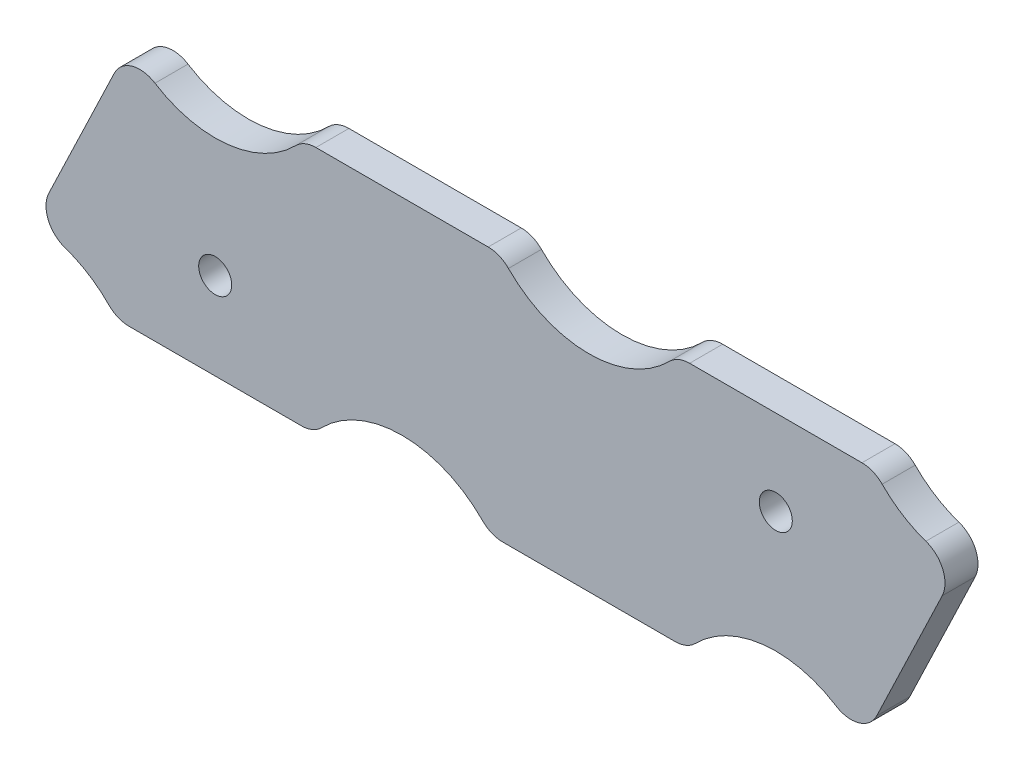
from build123d import *

# Parameters (mm, degrees)
BOSS_EXTRUDE1_DEPTH = 2.032
FILLET1_R           = 2
SKETCH4_R           = 1.016
CUT_EXTRUDE1_DEPTH  = 75.115872934
CUT_EXTRUDE2_DEPTH  = 75.115872934


with BuildPart() as part:
    # Sketch3 → Boss-Extrude1 (new body)
    with BuildSketch(Plane.XY):
        with BuildLine():
            Line((62.980794963, 30.66873734), (50.569205037, 30.66873734))
            ThreePointArc((50.569205037, 30.66873734), (45.275, 28.075), (39.980794963, 30.66873734))
            Line((39.980794963, 30.66873734), (27.569205037, 30.66873734))
            ThreePointArc((27.569205037, 30.66873734), (22.275, 28.075), (16.980794963, 30.66873734))
            Line((16.980794963, 30.66873734), (10.658308864, 17.473983742))
            ThreePointArc((10.658308864, 17.473983742), (13.670205209, 16.817167392), (16.069205037, 14.88126266))
            Line((16.069205037, 14.88126266), (28.480794963, 14.88126266))
            ThreePointArc((28.480794963, 14.88126266), (33.775, 17.475), (39.069205037, 14.88126266))
            Line((39.069205037, 14.88126266), (51.480794963, 14.88126266))
            ThreePointArc((51.480794963, 14.88126266), (56.775, 17.475), (62.069205037, 14.88126266))
            Line((62.069205037, 14.88126266), (68.391691136, 28.076016258))
            ThreePointArc((68.391691136, 28.076016258), (65.379794791, 28.732832608), (62.980794963, 30.66873734))
        make_face()
    extrude(amount=BOSS_EXTRUDE1_DEPTH)

    # Fillet1
    fillet1_edges = [part.edges().sort_by_distance(p)[0] for p in [
        (68.391691136, 28.076016258, 1.016),
        (62.069205037, 14.88126266, 1.016),
        (51.480794963, 14.88126266, 1.016),
        (39.069205037, 14.88126266, 1.016),
        (28.480794963, 14.88126266, 1.016),
        (16.069205037, 14.88126266, 1.016),
        (10.658308864, 17.473983742, 1.016),
        (16.980794963, 30.66873734, 1.016),
        (27.569205037, 30.66873734, 1.016),
        (39.980794963, 30.66873734, 1.016),
        (50.569205037, 30.66873734, 1.016),
        (62.980794963, 30.66873734, 1.016),
    ]]
    fillet(fillet1_edges, radius=FILLET1_R)

    # Sketch4 → Cut-Extrude1 (cut, through all)
    with BuildSketch(Plane.XY.offset(2.032)):
        with Locations((22.275, 20.49206771)):
            Circle(SKETCH4_R)
        with Locations((56.775, 25.169579009)):
            Circle(SKETCH4_R)
    extrude(amount=-CUT_EXTRUDE1_DEPTH, mode=Mode.SUBTRACT)

    # Sketch6 → Cut-Extrude2 (cut, through all)
    with BuildSketch(Plane.XY.offset(2.032)):
        with BuildLine():
            Line((62.077939702, 30.66873734), (51.472060298, 30.66873734))
            ThreePointArc((51.472060298, 30.66873734), (50.699880618, 30.513659708), (50.047448735, 30.072475883))
            ThreePointArc((50.047448735, 30.072475883), (45.275, 28.075), (40.502551265, 30.072475883))
            ThreePointArc((40.502551265, 30.072475883), (39.850119382, 30.513659708), (39.077939702, 30.66873734))
            Line((39.077939702, 30.66873734), (28.472060298, 30.66873734))
            ThreePointArc((28.472060298, 30.66873734), (27.699880618, 30.513659708), (27.047448735, 30.072475883))
            ThreePointArc((27.047448735, 30.072475883), (23.046259875, 28.119539219), (18.704481797, 29.105661435))
            ThreePointArc((18.704481797, 29.105661435), (17.084104729, 29.334902549), (15.835023411, 28.277561926))
            Line((15.835023411, 28.277561926), (11.804080417, 19.865159157))
            ThreePointArc((11.804080417, 19.865159157), (11.762608918, 18.229172162), (12.956514205, 17.109902981))
            ThreePointArc((12.956514205, 17.109902981), (14.346493431, 16.443724254), (15.547448735, 15.477524117))
            ThreePointArc((15.547448735, 15.477524117), (16.199880618, 15.036340292), (16.972060298, 14.88126266))
            Line((16.972060298, 14.88126266), (27.577939702, 14.88126266))
            ThreePointArc((27.577939702, 14.88126266), (28.350119382, 15.036340292), (29.002551265, 15.477524117))
            ThreePointArc((29.002551265, 15.477524117), (33.775, 17.475), (38.547448735, 15.477524117))
            ThreePointArc((38.547448735, 15.477524117), (39.199880618, 15.036340292), (39.972060298, 14.88126266))
            Line((39.972060298, 14.88126266), (50.577939702, 14.88126266))
            ThreePointArc((50.577939702, 14.88126266), (51.350119382, 15.036340292), (52.002551265, 15.477524117))
            ThreePointArc((52.002551265, 15.477524117), (56.003740125, 17.430460781), (60.345518203, 16.444338565))
            ThreePointArc((60.345518203, 16.444338565), (61.965895271, 16.215097451), (63.214976589, 17.272438074))
            Line((63.214976589, 17.272438074), (67.245919583, 25.684840843))
            ThreePointArc((67.245919583, 25.684840843), (67.287391082, 27.320827838), (66.093485795, 28.440097019))
            ThreePointArc((66.093485795, 28.440097019), (64.703506569, 29.106275746), (63.502551265, 30.072475883))
            ThreePointArc((63.502551265, 30.072475883), (62.850119382, 30.513659708), (62.077939702, 30.66873734))
        make_face()
        with BuildLine():
            Line((16.064084682, 28.1678034), (12.033141688, 19.755400631))
            ThreePointArc((12.033141688, 19.755400631), (11.99693707, 18.327183984), (13.039216385, 17.350061989))
            ThreePointArc((13.039216385, 17.350061989), (14.481890346, 16.658628129), (15.728374403, 15.655798912))
            ThreePointArc((15.728374403, 15.655798912), (16.297947437, 15.270645433), (16.972060298, 15.13526266))
            Line((16.972060298, 15.13526266), (27.577939702, 15.13526266))
            ThreePointArc((27.577939702, 15.13526266), (28.252052563, 15.270645433), (28.821625597, 15.655798912))
            ThreePointArc((28.821625597, 15.655798912), (33.775, 17.729), (38.728374403, 15.655798912))
            ThreePointArc((38.728374403, 15.655798912), (39.297947437, 15.270645433), (39.972060298, 15.13526266))
            Line((39.972060298, 15.13526266), (50.577939702, 15.13526266))
            ThreePointArc((50.577939702, 15.13526266), (51.252052563, 15.270645433), (51.821625597, 15.655798912))
            ThreePointArc((51.821625597, 15.655798912), (55.974501318, 17.682772279), (60.480878147, 16.659265728))
            ThreePointArc((60.480878147, 16.659265728), (61.895467327, 16.459138236), (62.985915318, 17.3821966))
            Line((62.985915318, 17.3821966), (67.016858312, 25.794599369))
            ThreePointArc((67.016858312, 25.794599369), (67.05306293, 27.222816016), (66.010783615, 28.199938011))
            ThreePointArc((66.010783615, 28.199938011), (64.568109654, 28.891371871), (63.321625597, 29.894201088))
            ThreePointArc((63.321625597, 29.894201088), (62.752052563, 30.279354567), (62.077939702, 30.41473734))
            Line((62.077939702, 30.41473734), (51.472060298, 30.41473734))
            ThreePointArc((51.472060298, 30.41473734), (50.797947437, 30.279354567), (50.228374403, 29.894201088))
            ThreePointArc((50.228374403, 29.894201088), (45.275, 27.821), (40.321625597, 29.894201088))
            ThreePointArc((40.321625597, 29.894201088), (39.752052563, 30.279354567), (39.077939702, 30.41473734))
            Line((39.077939702, 30.41473734), (28.472060298, 30.41473734))
            ThreePointArc((28.472060298, 30.41473734), (27.797947437, 30.279354567), (27.228374403, 29.894201088))
            ThreePointArc((27.228374403, 29.894201088), (23.075498682, 27.867227721), (18.569121853, 28.890734272))
            ThreePointArc((18.569121853, 28.890734272), (17.154532673, 29.090861764), (16.064084682, 28.1678034))
        make_face(mode=Mode.SUBTRACT)
    extrude(amount=-CUT_EXTRUDE2_DEPTH, mode=Mode.SUBTRACT)


solid = part.part
